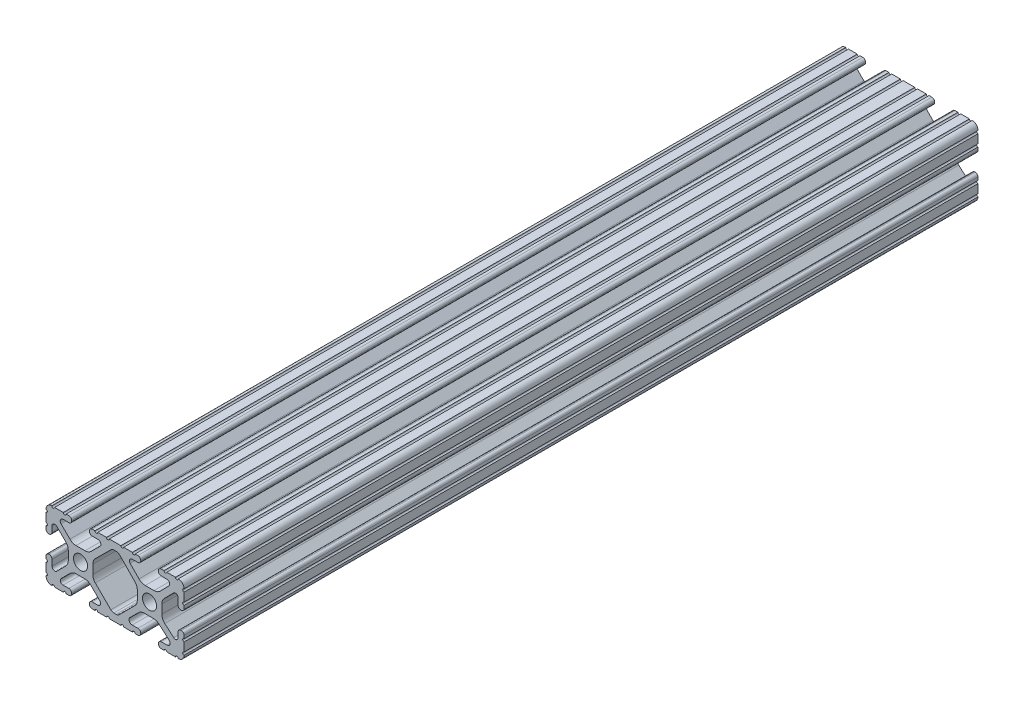
from build123d import *

# Parameters (mm, degrees)
SKETCH1_R           = 2.6035
BOSS_EXTRUDE1_DEPTH = 146.05


with BuildPart() as part:
    # Sketch1 → Boss-Extrude1 (new, symmetric)
    with BuildSketch(Plane.XY):
        with BuildLine():
            Line((18.01710265, 12.7), (16.98745015, 12.7))
            ThreePointArc((16.98745015, 12.7), (16.245730386, 12.392769614), (15.9385, 11.65104985))
            Line((15.9385, 11.65104985), (15.9385, 11.53922))
            ThreePointArc((15.9385, 11.53922), (16.245750844, 10.797450844), (16.98752, 10.4902))
            Line((16.98752, 10.4902), (19.116384363, 10.4902))
            ThreePointArc((19.116384363, 10.4902), (20.052502933, 9.869096983), (19.844087081, 8.765172272))
            Line((19.844087081, 8.765172272), (16.618993479, 5.455112286))
            ThreePointArc((16.618993479, 5.455112286), (15.578994274, 4.745442459), (14.344932584, 4.4958))
            Line((14.344932584, 4.4958), (11.083317835, 4.4958))
            ThreePointArc((11.083317835, 4.4958), (9.854330953, 4.743306833), (8.816955189, 5.447238587))
            Line((8.816955189, 5.447238587), (5.564154119, 8.762652677))
            ThreePointArc((5.564154119, 8.762652677), (5.352591412, 9.867473037), (6.289393385, 10.4902))
            Line((6.289393385, 10.4902), (8.41248, 10.4902))
            ThreePointArc((8.41248, 10.4902), (9.154249156, 10.797450844), (9.4615, 11.53922))
            Line((9.4615, 11.53922), (9.4615, 11.65104985))
            ThreePointArc((9.4615, 11.65104985), (9.154269614, 12.392769614), (8.41254985, 12.7))
            Line((8.41254985, 12.7), (7.38288465, 12.7))
            ThreePointArc((7.38288465, 12.7), (6.87488465, 12.192), (6.36688465, 12.7))
            Line((6.36688465, 12.7), (3.14958095, 12.7))
            ThreePointArc((3.14958095, 12.7), (2.64158095, 12.192), (2.13358095, 12.7))
            Line((2.13358095, 12.7), (-2.13358095, 12.7))
            ThreePointArc((-2.13358095, 12.7), (-2.64158095, 12.192), (-3.14958095, 12.7))
            Line((-3.14958095, 12.7), (-6.36689735, 12.7))
            ThreePointArc((-6.36689735, 12.7), (-6.87489735, 12.192), (-7.38289735, 12.7))
            Line((-7.38289735, 12.7), (-8.41254985, 12.7))
            ThreePointArc((-8.41254985, 12.7), (-9.154269614, 12.392769614), (-9.4615, 11.65104985))
            Line((-9.4615, 11.65104985), (-9.4615, 11.53922))
            ThreePointArc((-9.4615, 11.53922), (-9.154249156, 10.797450844), (-8.41248, 10.4902))
            Line((-8.41248, 10.4902), (-6.283641037, 10.4902))
            ThreePointArc((-6.283641037, 10.4902), (-5.297291557, 9.829633109), (-5.532576693, 8.666071843))
            Line((-5.532576693, 8.666071843), (-8.809985098, 5.416263103))
            ThreePointArc((-8.809985098, 5.416263103), (-9.836720513, 4.734920264), (-11.045536121, 4.4958))
            Line((-11.045536121, 4.4958), (-14.354463879, 4.4958))
            ThreePointArc((-14.354463879, 4.4958), (-15.563279487, 4.734920264), (-16.590014902, 5.416263103))
            Line((-16.590014902, 5.416263103), (-19.867423307, 8.666071843))
            ThreePointArc((-19.867423307, 8.666071843), (-20.102708443, 9.829633109), (-19.116358963, 10.4902))
            Line((-19.116358963, 10.4902), (-16.98752, 10.4902))
            ThreePointArc((-16.98752, 10.4902), (-16.245750844, 10.797450844), (-15.9385, 11.53922))
            Line((-15.9385, 11.53922), (-15.9385, 11.65104985))
            ThreePointArc((-15.9385, 11.65104985), (-16.245730386, 12.392769614), (-16.98745015, 12.7))
            Line((-16.98745015, 12.7), (-18.01711535, 12.7))
            ThreePointArc((-18.01711535, 12.7), (-18.52511535, 12.192), (-19.03311535, 12.7))
            Line((-19.03311535, 12.7), (-22.2504, 12.7))
            ThreePointArc((-22.2504, 12.7), (-22.758323491, 12.192000006), (-23.266399977, 12.699846982))
            ThreePointArc((-23.266399977, 12.699846982), (-24.782522516, 12.082522516), (-25.399846982, 10.566399977))
            ThreePointArc((-25.399846982, 10.566399977), (-24.892000006, 10.058323491), (-25.4, 9.5504))
            Line((-25.4, 9.5504), (-25.4, 6.3330836))
            ThreePointArc((-25.4, 6.3330836), (-24.892, 5.8250836), (-25.4, 5.3170836))
            Line((-25.4, 5.3170836), (-25.4, 4.237520184))
            ThreePointArc((-25.4, 4.237520184), (-25.107393763, 3.531106237), (-24.400979816, 3.2385))
            Line((-24.400979816, 3.2385), (-24.23922, 3.2385))
            ThreePointArc((-24.23922, 3.2385), (-23.497450844, 3.545750844), (-23.1902, 4.28752))
            Line((-23.1902, 4.28752), (-23.1902, 6.334741132))
            ThreePointArc((-23.1902, 6.334741132), (-22.556026952, 7.286023527), (-21.434002553, 7.066535717))
            Line((-21.434002553, 7.066535717), (-18.147950853, 3.808156468))
            ThreePointArc((-18.147950853, 3.808156468), (-17.452759693, 2.774838327), (-17.208501877, 1.553619571))
            Line((-17.208501877, 1.553619571), (-17.208501877, -1.695179196))
            ThreePointArc((-17.208501877, -1.695179196), (-17.450738657, -2.911536421), (-18.140486065, -3.942289578))
            Line((-18.140486065, -3.942289578), (-21.431579576, -7.227386226))
            ThreePointArc((-21.431579576, -7.227386226), (-22.55444896, -7.449940594), (-23.1902, -6.498002195))
            Line((-23.1902, -6.498002195), (-23.1902, -4.28752))
            ThreePointArc((-23.1902, -4.28752), (-23.497450844, -3.545750844), (-24.23922, -3.2385))
            Line((-24.23922, -3.2385), (-24.35098, -3.2385))
            ThreePointArc((-24.35098, -3.2385), (-25.092749156, -3.545750844), (-25.4, -4.28752))
            Line((-25.4, -4.28752), (-25.4, -5.3171344))
            ThreePointArc((-25.4, -5.3171344), (-24.892, -5.8251344), (-25.4, -6.3331344))
            Line((-25.4, -6.3331344), (-25.4, -9.5504))
            ThreePointArc((-25.4, -9.5504), (-24.892000006, -10.058323491), (-25.399846982, -10.566399977))
            ThreePointArc((-25.399846982, -10.566399977), (-24.782522516, -12.082522516), (-23.266399977, -12.699846982))
            ThreePointArc((-23.266399977, -12.699846982), (-22.758323491, -12.192000006), (-22.2504, -12.7))
            Line((-22.2504, -12.7), (-19.03308995, -12.7))
            ThreePointArc((-19.03308995, -12.7), (-18.52508995, -12.192), (-18.01708995, -12.7))
            Line((-18.01708995, -12.7), (-16.9874692, -12.7))
            ThreePointArc((-16.9874692, -12.7), (-16.245700044, -12.392749156), (-15.9384492, -11.65098))
            Line((-15.9384492, -11.65098), (-15.9384492, -11.53922))
            ThreePointArc((-15.9384492, -11.53922), (-16.245700044, -10.797450844), (-16.9874692, -10.4902))
            Line((-16.9874692, -10.4902), (-19.116358963, -10.4902))
            ThreePointArc((-19.116358963, -10.4902), (-20.055197748, -9.862578342), (-19.834124023, -8.755124678))
            Line((-19.834124023, -8.755124678), (-16.49660751, -5.423689618))
            ThreePointArc((-16.49660751, -5.423689618), (-15.467274017, -4.736928798), (-14.253591699, -4.4958))
            Line((-14.253591699, -4.4958), (-11.146408301, -4.4958))
            ThreePointArc((-11.146408301, -4.4958), (-9.932725983, -4.736928798), (-8.90339249, -5.423689618))
            Line((-8.90339249, -5.423689618), (-5.565875977, -8.755124678))
            ThreePointArc((-5.565875977, -8.755124678), (-5.344802252, -9.862578342), (-6.283641037, -10.4902))
            Line((-6.283641037, -10.4902), (-8.4125308, -10.4902))
            ThreePointArc((-8.4125308, -10.4902), (-9.154299956, -10.797450844), (-9.4615508, -11.53922))
            Line((-9.4615508, -11.53922), (-9.4615508, -11.65098))
            ThreePointArc((-9.4615508, -11.65098), (-9.154299956, -12.392749156), (-8.4125308, -12.7))
            Line((-8.4125308, -12.7), (-7.38287195, -12.7))
            ThreePointArc((-7.38287195, -12.7), (-6.87487195, -12.192), (-6.36687195, -12.7))
            Line((-6.36687195, -12.7), (-3.14960635, -12.7))
            ThreePointArc((-3.14960635, -12.7), (-2.64160635, -12.192), (-2.13360635, -12.7))
            Line((-2.13360635, -12.7), (2.13360635, -12.7))
            ThreePointArc((2.13360635, -12.7), (2.64159365, -12.1920127), (3.14958095, -12.7))
            Line((3.14958095, -12.7), (6.36691005, -12.7))
            ThreePointArc((6.36691005, -12.7), (6.87491005, -12.192), (7.38291005, -12.7))
            Line((7.38291005, -12.7), (8.4125308, -12.7))
            ThreePointArc((8.4125308, -12.7), (9.154299956, -12.392749156), (9.4615508, -11.65098))
            Line((9.4615508, -11.65098), (9.4615508, -11.53922))
            ThreePointArc((9.4615508, -11.53922), (9.154299956, -10.797450844), (8.4125308, -10.4902))
            Line((8.4125308, -10.4902), (6.289393385, -10.4902))
            ThreePointArc((6.289393385, -10.4902), (5.231590322, -9.783049717), (5.480677245, -8.535265862))
            Line((5.480677245, -8.535265862), (8.597933595, -5.423689618))
            ThreePointArc((8.597933595, -5.423689618), (9.627267088, -4.736928798), (10.840949406, -4.4958))
            Line((10.840949406, -4.4958), (14.102564155, -4.4958))
            ThreePointArc((14.102564155, -4.4958), (15.215927525, -4.697410182), (16.187895372, -5.276636531))
            Line((16.187895372, -5.276636531), (19.868247549, -8.482246082))
            ThreePointArc((19.868247549, -8.482246082), (20.188435806, -9.746879864), (19.116384363, -10.4902))
            Line((19.116384363, -10.4902), (16.9874692, -10.4902))
            ThreePointArc((16.9874692, -10.4902), (16.245700044, -10.797450844), (15.9384492, -11.53922))
            Line((15.9384492, -11.53922), (15.9384492, -11.65098))
            ThreePointArc((15.9384492, -11.65098), (16.245700044, -12.392749156), (16.9874692, -12.7))
            Line((16.9874692, -12.7), (18.01710265, -12.7))
            ThreePointArc((18.01710265, -12.7), (18.52510265, -12.192), (19.03310265, -12.7))
            Line((19.03310265, -12.7), (22.2504, -12.7))
            ThreePointArc((22.2504, -12.7), (22.758323491, -12.192000006), (23.266399977, -12.699846982))
            ThreePointArc((23.266399977, -12.699846982), (24.782522516, -12.082522516), (25.399846982, -10.566399977))
            ThreePointArc((25.399846982, -10.566399977), (24.892000006, -10.058323492), (25.4, -9.550400001))
            Line((25.4, -9.550400001), (25.4, -6.333083592))
            ThreePointArc((25.4, -6.333083592), (24.892000001, -5.825083593), (25.4, -5.317083593))
            Line((25.4, -5.317083593), (25.4, -4.237520184))
            ThreePointArc((25.4, -4.237520184), (25.107393763, -3.531106237), (24.400979816, -3.2385))
            Line((24.400979816, -3.2385), (24.189220184, -3.2385))
            ThreePointArc((24.189220184, -3.2385), (23.482806237, -3.531106237), (23.1902, -4.237520184))
            Line((23.1902, -4.237520184), (23.1902, -6.155876159))
            ThreePointArc((23.1902, -6.155876159), (22.62232736, -7.038258539), (21.583974541, -6.886926384))
            Line((21.583974541, -6.886926384), (18.29817066, -4.024970844))
            ThreePointArc((18.29817066, -4.024970844), (17.493730985, -2.946044689), (17.208501877, -1.630807374))
            Line((17.208501877, -1.630807374), (17.208501877, 1.630807374))
            ThreePointArc((17.208501877, 1.630807374), (17.442348332, 2.82673414), (18.109440981, 3.846495088))
            Line((18.109440981, 3.846495088), (21.526346532, 7.353420386))
            ThreePointArc((21.526346532, 7.353420386), (22.585896263, 7.574939077), (23.1902, 6.676867167))
            Line((23.1902, 6.676867167), (23.1902, 4.237520184))
            ThreePointArc((23.1902, 4.237520184), (23.482806237, 3.531106237), (24.189220184, 3.2385))
            Line((24.189220184, 3.2385), (24.400979816, 3.2385))
            ThreePointArc((24.400979816, 3.2385), (25.107393763, 3.531106237), (25.4, 4.237520184))
            Line((25.4, 4.237520184), (25.4, 5.3170836))
            ThreePointArc((25.4, 5.3170836), (24.891949193, 5.825134407), (25.4, 6.333185215))
            Line((25.4, 6.333185215), (25.4, 9.550400015))
            ThreePointArc((25.4, 9.550400015), (24.892000013, 10.058323498), (25.399846982, 10.566399977))
            ThreePointArc((25.399846982, 10.566399977), (24.782522516, 12.082522516), (23.266399977, 12.699846982))
            ThreePointArc((23.266399977, 12.699846982), (22.758323491, 12.192000006), (22.2504, 12.7))
            Line((22.2504, 12.7), (19.03310265, 12.7))
            ThreePointArc((19.03310265, 12.7), (18.52510265, 12.192), (18.01710265, 12.7))
        make_face()
        with Locations((-12.7, 0)):
            Circle(SKETCH1_R, mode=Mode.SUBTRACT)
        with Locations((12.7, 0)):
            Circle(SKETCH1_R, mode=Mode.SUBTRACT)
        with BuildLine():
            Line((-7.259513935, -3.869413038), (-1.545748891, -9.572766749))
            ThreePointArc((-1.545748891, -9.572766749), (-1.035199478, -9.913400116), (-0.433213048, -10.033))
            Line((-0.433213048, -10.033), (0.433213048, -10.033))
            ThreePointArc((0.433213048, -10.033), (1.035199478, -9.913400116), (1.545748891, -9.572766749))
            Line((1.545748891, -9.572766749), (7.259513935, -3.869413038))
            ThreePointArc((7.259513935, -3.869413038), (7.949261343, -2.838659881), (8.191498123, -1.622302656))
            Line((8.191498123, -1.622302656), (8.191498123, 1.622302656))
            ThreePointArc((8.191498123, 1.622302656), (7.955573352, 2.823327967), (7.282860769, 3.845864069))
            Line((7.282860769, 3.845864069), (1.675572808, 9.561086461))
            ThreePointArc((1.675572808, 9.561086461), (1.161034429, 9.910236611), (0.551456936, 10.033))
            Line((0.551456936, 10.033), (-0.395199982, 10.033))
            ThreePointArc((-0.395199982, 10.033), (-0.994772524, 9.914396349), (-1.50403329, 9.576450301))
            Line((-1.50403329, 9.576450301), (-7.252049147, 3.876839553))
            ThreePointArc((-7.252049147, 3.876839553), (-7.947240307, 2.843521412), (-8.191498123, 1.622302656))
            Line((-8.191498123, 1.622302656), (-8.191498123, -1.622302656))
            ThreePointArc((-8.191498123, -1.622302656), (-7.949261343, -2.838659881), (-7.259513935, -3.869413038))
        make_face(mode=Mode.SUBTRACT)
    extrude(amount=BOSS_EXTRUDE1_DEPTH, both=True)


solid = part.part
